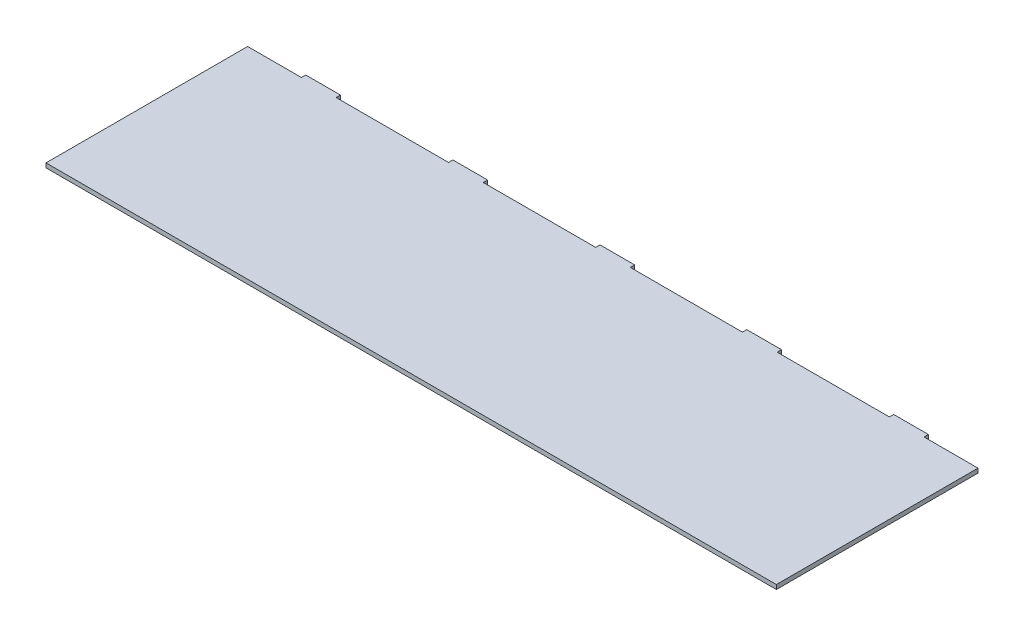
from build123d import *

# Parameters (mm, degrees)
SKETCH1_W           = 534.99766
SKETCH1_H           = 147.69846
BOSS_EXTRUDE1_DEPTH = 3.175
SKETCH2_W           = 25.4
SKETCH2_H           = 3.175
BOSS_EXTRUDE2_DEPTH = 3.175


with BuildPart() as part:
    # Sketch1 → Boss-Extrude1 (new body)
    with BuildSketch(Plane(origin=(0, 0, 0), x_dir=(1, 0, 0), z_dir=(0, 1, 0))):
        with Locations((267.49883, 73.84923)):
            Rectangle(SKETCH1_W, SKETCH1_H)
    extrude(amount=BOSS_EXTRUDE1_DEPTH)

    # Sketch2 → Boss-Extrude2 (add)
    with BuildSketch(Plane(origin=(0, 0, -147.69846), x_dir=(-1, 0, 0), z_dir=(0, 0, -1))):
        with Locations((-482.77145, 1.5875)):
            Rectangle(SKETCH2_W, SKETCH2_H)
        with Locations((-375.14403, 1.5875)):
            Rectangle(SKETCH2_W, SKETCH2_H)
        with Locations((-267.665260384, 1.5875)):
            Rectangle(SKETCH2_W, SKETCH2_H)
        with Locations((-159.888954488, 1.5875)):
            Rectangle(SKETCH2_W, SKETCH2_H)
        with Locations((-52.098109833, 1.5875)):
            Rectangle(SKETCH2_W, SKETCH2_H)
    extrude(amount=BOSS_EXTRUDE2_DEPTH)


solid = part.part
